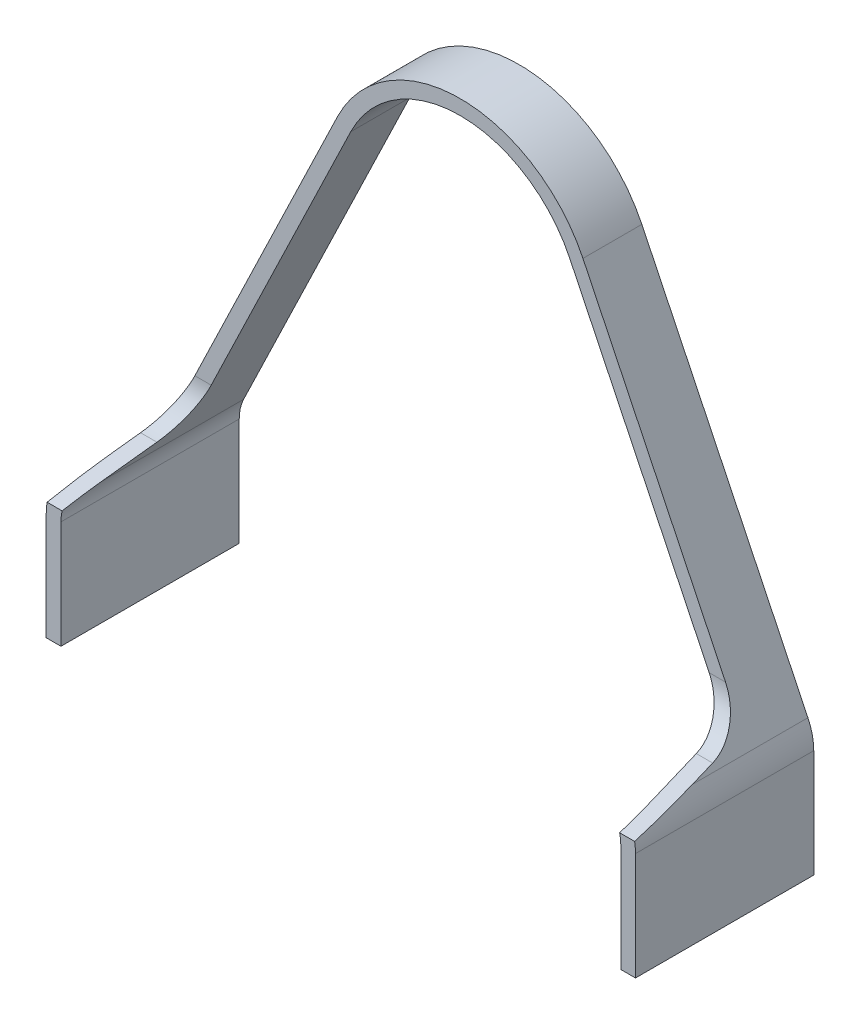
from build123d import *

# Parameters (mm, degrees)
EXTRUDE_1_DEPTH     = 121
CUT_EXTRUDE_1_DEPTH = 506.269235161


with BuildPart() as part:
    # 草图1 → 凸台-拉伸1 (new body)
    with BuildSketch(Plane.XY):
        with BuildLine():
            Line((-190, -210.857487736), (-190, -284))
            Line((-190, -284), (-200, -284))
            Line((-200, -284), (-200, -210.857487736))
            ThreePointArc((-200, -210.857487736), (-198.994242885, -201.944069658), (-196.027548908, -193.478888262))
            Line((-196.027548908, -193.478888262), (-83.313706851, 40.188011282))
            ThreePointArc((-83.313706851, 40.188011282), (0, 92.5), (83.313706851, 40.188011282))
            Line((83.313706851, 40.188011282), (196.027548908, -193.478888262))
            ThreePointArc((196.027548908, -193.478888262), (198.994242885, -201.944069658), (200, -210.857487736))
            Line((200, -210.857487736), (200, -284))
            Line((200, -284), (190, -284))
            Line((190, -284), (190, -210.857487736))
            ThreePointArc((190, -210.857487736), (189.245682164, -204.172424177), (187.020661681, -197.82353813))
            Line((187.020661681, -197.82353813), (74.306819623, 35.843361414))
            ThreePointArc((74.306819623, 35.843361414), (0, 82.5), (-74.306819623, 35.843361414))
            Line((-74.306819623, 35.843361414), (-187.020661681, -197.82353813))
            ThreePointArc((-187.020661681, -197.82353813), (-189.245682164, -204.172424177), (-190, -210.857487736))
        make_face()
    extrude(amount=EXTRUDE_1_DEPTH)

    # 草图2 → 切除-拉伸1 (cut, through all)
    with BuildSketch(Plane.ZY.offset(200)):
        with BuildLine():
            Line((40, 92.5), (40, -160.506441654))
            ThreePointArc((40, -160.506441654), (46.380696587, -179.003157748), (62.808567085, -189.631744959))
            Line((62.808567085, -189.631744959), (121, -204))
            Line((121, -204), (121, 92.5))
            Line((121, 92.5), (40, 92.5))
        make_face()
    extrude(amount=-CUT_EXTRUDE_1_DEPTH, mode=Mode.SUBTRACT)


solid = part.part
